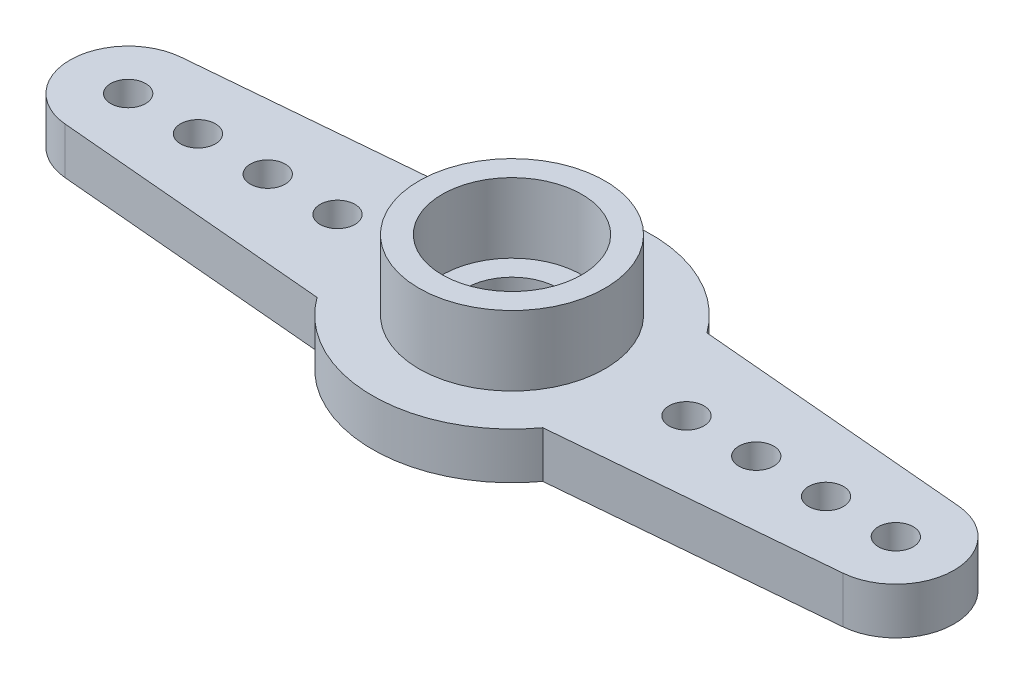
from build123d import *

# Parameters (mm, degrees)
SKETCH1_R           = 2
SKETCH1_R_2         = 0.75
BOSS_EXTRUDE1_DEPTH = 2
SKETCH2_R           = 4
SKETCH2_R_2         = 3
BOSS_EXTRUDE2_DEPTH = 3


with BuildPart() as part:
    # Sketch1 → Boss-Extrude1 (new body)
    with BuildSketch(Plane(origin=(0, 0, 0), x_dir=(1, 0, 0), z_dir=(0, 1, 0))):
        with BuildLine():
            Line((16.717889357, -2.490486745), (4.852765263, -3.528550595))
            ThreePointArc((4.852765263, -3.528550595), (0, -6), (-4.852765263, -3.528550595))
            Line((-4.852765263, -3.528550595), (-16.717889357, -2.490486745))
            ThreePointArc((-16.717889357, -2.490486745), (-19, 0), (-16.717889357, 2.490486745))
            Line((-16.717889357, 2.490486745), (-4.852765263, 3.528550595))
            ThreePointArc((-4.852765263, 3.528550595), (0, 6), (4.852765263, 3.528550595))
            Line((4.852765263, 3.528550595), (16.717889357, 2.490486745))
            ThreePointArc((16.717889357, 2.490486745), (19, 0), (16.717889357, -2.490486745))
        make_face()
        with Locations(Location((0, 0, 0), (0, 0, 270))):
            Circle(SKETCH1_R, mode=Mode.SUBTRACT)
        with Locations(Location((7.5, 0, 0), (0, 0, 270))):
            Circle(SKETCH1_R_2, mode=Mode.SUBTRACT)
        with Locations(Location((10.5, 0, 0), (0, 0, 270))):
            Circle(SKETCH1_R_2, mode=Mode.SUBTRACT)
        with Locations(Location((13.5, 0, 0), (0, 0, 270))):
            Circle(SKETCH1_R_2, mode=Mode.SUBTRACT)
        with Locations(Location((16.5, 0, 0), (0, 0, 270))):
            Circle(SKETCH1_R_2, mode=Mode.SUBTRACT)
        with Locations(Location((-16.5, 0, 0), (0, 0, 90))):
            Circle(SKETCH1_R_2, mode=Mode.SUBTRACT)
        with Locations(Location((-13.5, 0, 0), (0, 0, 90))):
            Circle(SKETCH1_R_2, mode=Mode.SUBTRACT)
        with Locations(Location((-10.5, 0, 0), (0, 0, 90))):
            Circle(SKETCH1_R_2, mode=Mode.SUBTRACT)
        with Locations(Location((-7.5, 0, 0), (0, 0, 90))):
            Circle(SKETCH1_R_2, mode=Mode.SUBTRACT)
    extrude(amount=BOSS_EXTRUDE1_DEPTH)

    # Sketch2 → Boss-Extrude2 (add)
    with BuildSketch(Plane(origin=(0, 2, 0), x_dir=(1, 0, 0), z_dir=(0, 1, 0))):
        with Locations(Location((0, 0, 0), (0, 0, 270))):
            Circle(SKETCH2_R)
        with Locations(Location((0, 0, 0), (0, 0, 270))):
            Circle(SKETCH2_R_2, mode=Mode.SUBTRACT)
    extrude(amount=BOSS_EXTRUDE2_DEPTH)


solid = part.part
